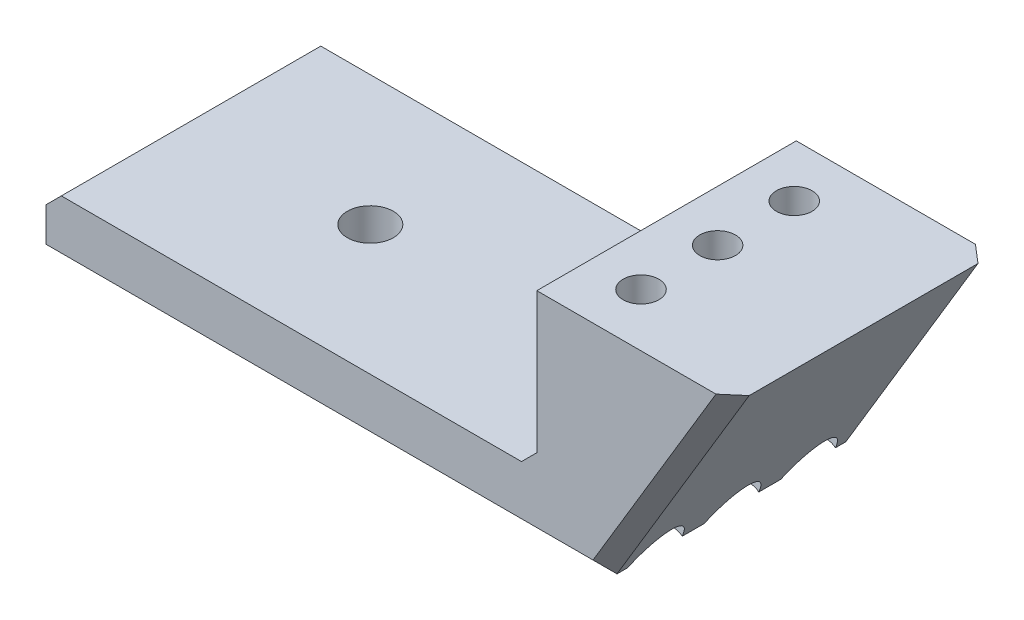
from build123d import *

# Parameters (mm, degrees)
BOSS_EXTRUDE1_DEPTH                     = 25.4
CBORE_FOR_M5_HEX_HEAD_BOLT1_D           = 3.5
CBORE_FOR_M5_HEX_HEAD_BOLT1_CBORE_D     = 6
CBORE_FOR_M5_HEX_HEAD_BOLT1_CBORE_DEPTH = 10
CHAMFER2_SIZE                           = 1.5
SKETCH7_R                               = 2.25
CUT_EXTRUDE1_DEPTH                      = 6.35
BOSS_EXTRUDE2_START                     = -0.12
SKETCH8_R                               = 1.75
BOSS_EXTRUDE2_DEPTH                     = 0.12


with BuildPart() as part:
    # Sketch1 → Boss-Extrude1 (new body)
    with BuildSketch(Plane.XY):
        Polygon((0, 0), (0, -15.24), (-48.05, -15.24), (-48.05, -21.59), (6.35, -21.59), (19.29, 0), (6.35, 0), align=None)
    extrude(amount=BOSS_EXTRUDE1_DEPTH)

    # CBORE for M5 Hex Head Bolt1 (through all)
    with Locations(Plane(origin=(5, -21.59, 20.2), x_dir=(-1, 0, 0), z_dir=(0, -1, 0))):
        with Locations((0, 0), (0, 7.5), (0, 15)):
            CounterBoreHole(CBORE_FOR_M5_HEX_HEAD_BOLT1_D / 2, CBORE_FOR_M5_HEX_HEAD_BOLT1_CBORE_D / 2, CBORE_FOR_M5_HEX_HEAD_BOLT1_CBORE_DEPTH)

    # Chamfer2
    chamfer2_edges = [part.edges().sort_by_distance(p)[0] for p in [
        (-48.05, -15.24, 12.7),
        (0, -15.24, 12.7),
        (-20.85, -21.59, 25.4),
        (12.82, -10.795, 25.4),
        (12.82, -10.795, 0),
        (-20.85, -21.59, 0),
    ]]
    chamfer(chamfer2_edges, length=CHAMFER2_SIZE)

    # Sketch7 → Cut-Extrude1 (cut)
    with BuildSketch(Plane.XZ.offset(21.59)):
        with Locations(Location((-29, 12.7, 0), (0, 0, 270))):
            Circle(SKETCH7_R)
    extrude(amount=-CUT_EXTRUDE1_DEPTH, mode=Mode.SUBTRACT)

    # Sketch8 → Boss-Extrude2 (add)
    with BuildSketch(Plane.XZ.offset(11.59).offset(BOSS_EXTRUDE2_START)):
        with Locations(Location((5, 20.2, 0), (0, 0, 270))):
            Circle(SKETCH8_R)
        with Locations(Location((5, 12.7, 0), (0, 0, 270))):
            Circle(SKETCH8_R)
        with Locations(Location((5, 5.2, 0), (0, 0, 270))):
            Circle(SKETCH8_R)
    extrude(amount=BOSS_EXTRUDE2_DEPTH)


solid = part.part
